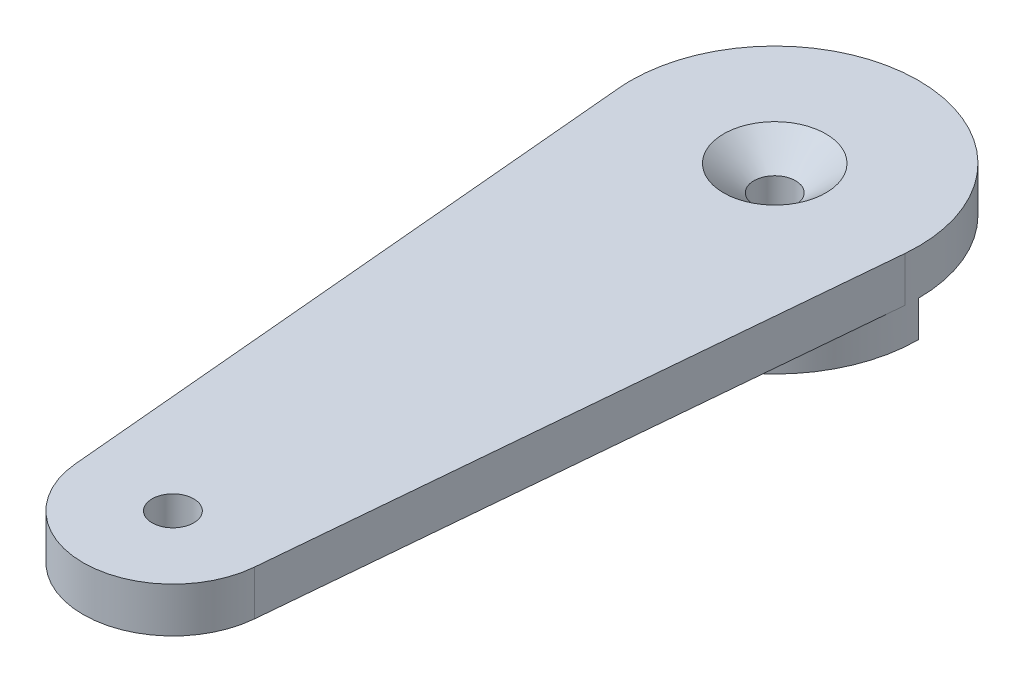
from build123d import *

# Parameters (mm, degrees)
SKETCH1_R                                         = 1.4732
BOSS_EXTRUDE1_DEPTH                               = 3.175
BOSS_EXTRUDE2_START                               = 2.54
BOSS_EXTRUDE2_DEPTH                               = 2.54
CSK_FOR_4_FLAT_HEAD_MACHINE_SCREW_100_D           = 2.9464
CSK_FOR_4_FLAT_HEAD_MACHINE_SCREW_100_CSINK_D     = 7.2285352
CSK_FOR_4_FLAT_HEAD_MACHINE_SCREW_100_CSINK_ANGLE = 100


with BuildPart() as part:
    # Sketch1 → Boss-Extrude1 (new body)
    with BuildSketch(Plane(origin=(0, 0, 0), x_dir=(1, 0, 0), z_dir=(0, 1, 0))):
        with BuildLine():
            Line((-10.119178406, -0.909850746), (-6.324486504, -43.113656716))
            ThreePointArc((-6.324486504, -43.113656716), (0, -48.895), (6.324486504, -43.113656716))
            Line((6.324486504, -43.113656716), (10.119178406, -0.909850746))
            ThreePointArc((10.119178406, -0.909850746), (0, 10.16), (-10.119178406, -0.909850746))
        make_face()
        with Locations(Location((0, -42.545, 0), (0, 0, 270))):
            Circle(SKETCH1_R, mode=Mode.SUBTRACT)
    extrude(amount=BOSS_EXTRUDE1_DEPTH)

    # Sketch2 → Boss-Extrude2 (add)
    with BuildSketch(Plane.XZ.offset(BOSS_EXTRUDE2_START)):
        with BuildLine():
            Line((7.62, 0), (10.16, 0))
            ThreePointArc((10.16, 0), (0, 10.16), (-10.16, 0))
            Line((-10.16, 0), (-7.62, 0))
            ThreePointArc((-7.62, 0), (0, -7.62), (7.62, 0))
        make_face()
    extrude(amount=-BOSS_EXTRUDE2_DEPTH)

    # CSK for #4 Flat Head Machine Screw (100)1 (through all)
    with Locations(Plane(origin=(0, 3.175, 0), x_dir=(1, 0, 0), z_dir=(0, 1, 0))):
        with Locations((0, 0)):
            CounterSinkHole(CSK_FOR_4_FLAT_HEAD_MACHINE_SCREW_100_D / 2, CSK_FOR_4_FLAT_HEAD_MACHINE_SCREW_100_CSINK_D / 2, counter_sink_angle=CSK_FOR_4_FLAT_HEAD_MACHINE_SCREW_100_CSINK_ANGLE)


solid = part.part
